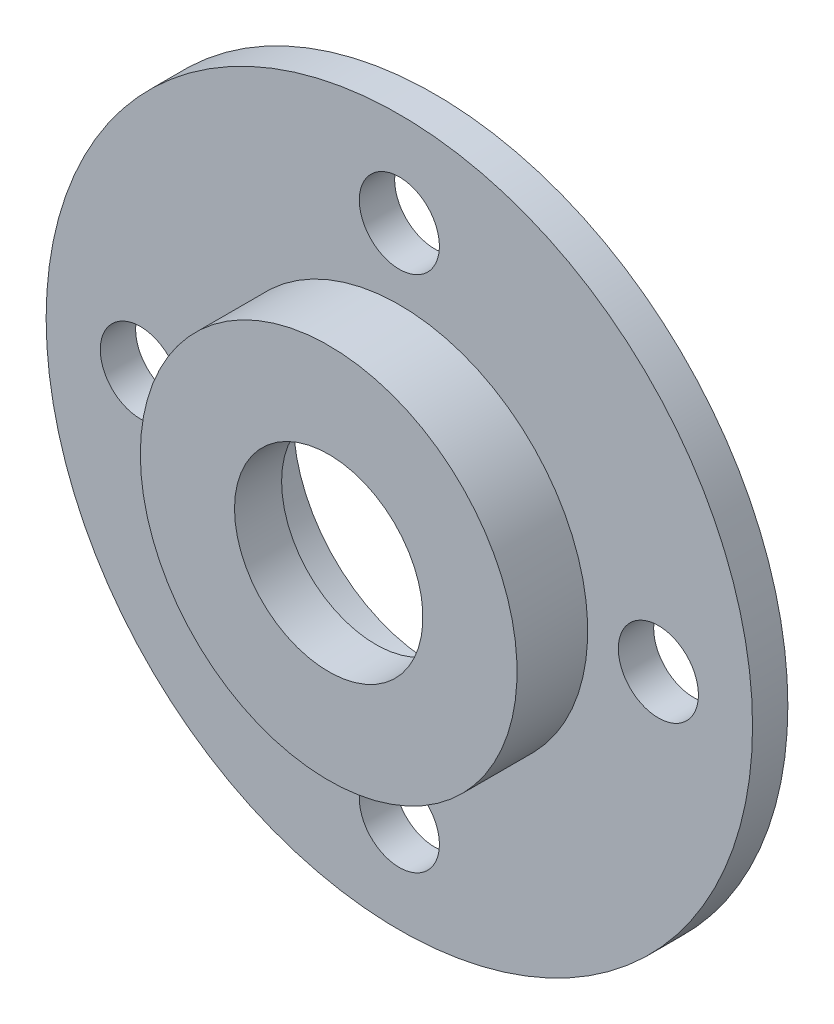
from build123d import *

# Parameters (mm, degrees)
M3_CLEARANCE_HOLE1_D = 3.4
CIRPATTERN1_COUNT    = 4


with BuildPart() as part:
    # Sketch1 → Revolve1 (revolve)
    with BuildSketch(Plane(origin=(0, 0, 0), x_dir=(1, 0, 0), z_dir=(0, 1, 0))):
        Polygon((4, 1.698663418), (4, -0.301336582), (8, -0.301336582), (8, 2.698663418), (15, 2.698663418), (15, 4.198663418), (6, 4.198663418), (6, 1.698663418), align=None)
    revolve(axis=Axis((0, 0, -9.651281217), (0, 0, 1)))

    # M3 Clearance Hole1 (through all)
    with Locations(Plane(origin=(0, 0, -4.198663418), x_dir=(-1, 0, 0), z_dir=(0, 0, -1))):
        with Locations((-11, 0)):
            m3_clearance_hole1 = Hole(M3_CLEARANCE_HOLE1_D / 2)

    # CirPattern1: M3 Clearance Hole1 ×4 about axis
    cirpattern1_axis = Axis((0, 0, 11.676269368), (0, 0, -1))
    for i in range(1, CIRPATTERN1_COUNT):
        add(m3_clearance_hole1.rotate(cirpattern1_axis, i * 360 / CIRPATTERN1_COUNT), mode=Mode.SUBTRACT)


solid = part.part
